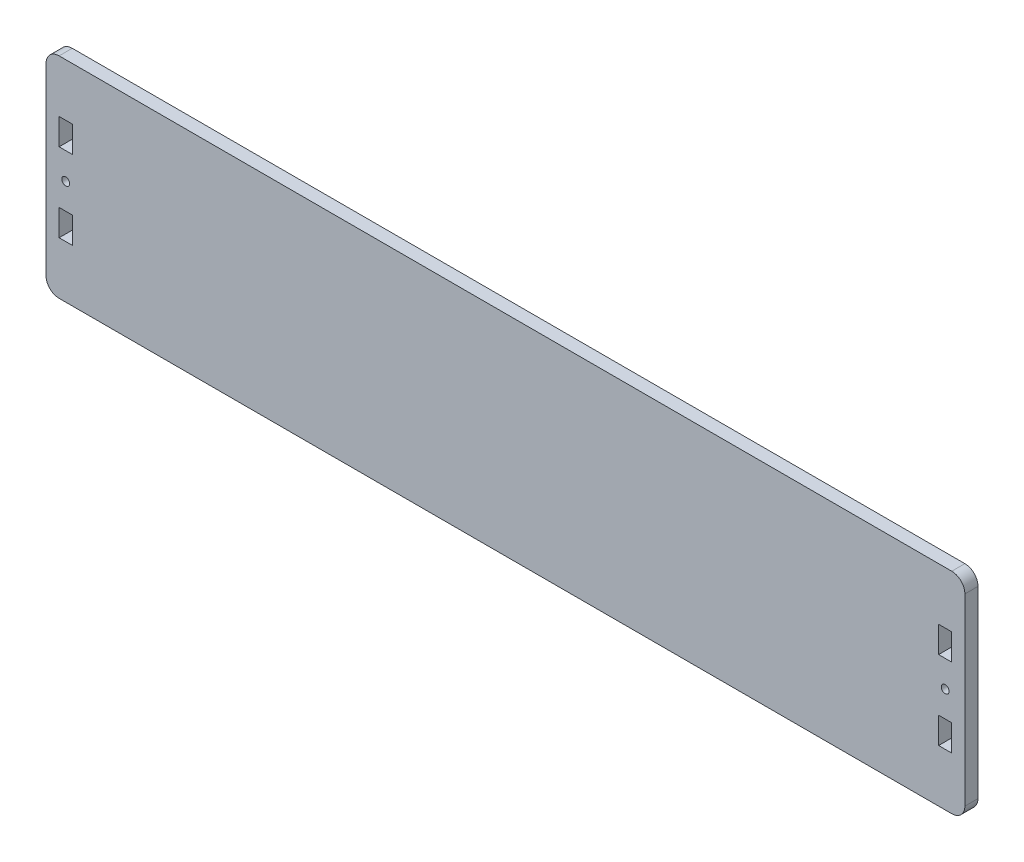
from build123d import *

# Parameters (mm, degrees)
ESQUISSE1_W        = 350
ESQUISSE1_H        = 80
ESQUISSE1_R        = 1.5
ESQUISSE1_W_2      = 5
ESQUISSE1_H_2      = 10
BOSS_EXTRU_1_DEPTH = 5
CONG_1_R           = 5


with BuildPart() as part:
    # Esquisse1 → Boss.-Extru.1 (new body)
    with BuildSketch(Plane.XY):
        with Locations((78.369154872, 12.458586165)):
            Rectangle(ESQUISSE1_W, ESQUISSE1_H)
        with Locations((-89.130845128, 12.3040989)):
            Circle(ESQUISSE1_R, mode=Mode.SUBTRACT)
        with Locations(Location((245.869154872, 12.3040989, 0), (0, 0, 180))):
            Circle(ESQUISSE1_R, mode=Mode.SUBTRACT)
        with Locations((-89.130845128, 27.458586165)):
            Rectangle(ESQUISSE1_W_2, ESQUISSE1_H_2, mode=Mode.SUBTRACT)
        with Locations((-89.130845128, -2.541413835)):
            Rectangle(ESQUISSE1_W_2, ESQUISSE1_H_2, mode=Mode.SUBTRACT)
        with Locations((245.869154872, -2.541413835)):
            Rectangle(ESQUISSE1_W_2, ESQUISSE1_H_2, mode=Mode.SUBTRACT)
        with Locations((245.869154872, 27.458586165)):
            Rectangle(ESQUISSE1_W_2, ESQUISSE1_H_2, mode=Mode.SUBTRACT)
    extrude(amount=BOSS_EXTRU_1_DEPTH)

    # Congé1
    cong_1_edges = [part.edges().sort_by_distance(p)[0] for p in [
        (-96.630845128, 52.458586165, 2.5),
        (253.369154872, 52.458586165, 2.5),
        (253.369154872, -27.541413835, 2.5),
        (-96.630845128, -27.541413835, 2.5),
    ]]
    fillet(cong_1_edges, radius=CONG_1_R)


solid = part.part
